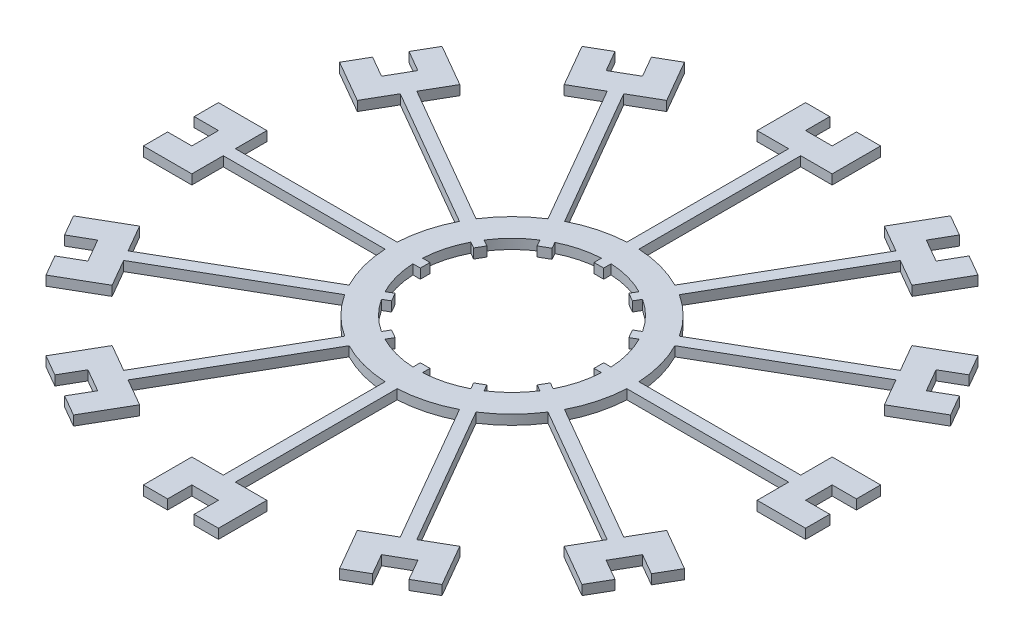
from build123d import *

# Parameters (mm, degrees)
BOSS_EXTRUDE1_DEPTH = 1


with BuildPart() as part:
    # Sketch1 → Boss-Extrude1 (new, symmetric)
    with BuildSketch(Plane(origin=(0, 0, 0), x_dir=(1, 0, 0), z_dir=(0, 1, 0))):
        with BuildLine():
            Line((-1.25, -58.39), (-7.75, -58.39))
            Line((-7.75, -58.39), (-7.75, -68.39))
            Line((-7.75, -68.39), (-2.75, -68.39))
            Line((-2.75, -68.39), (-2.75, -63.39))
            Line((-2.75, -63.39), (2.75, -63.39))
            Line((2.75, -63.39), (2.75, -68.39))
            Line((2.75, -68.39), (7.75, -68.39))
            Line((7.75, -68.39), (7.75, -58.39))
            Line((7.75, -58.39), (1.25, -58.39))
            Line((1.25, -58.39), (1.25, -24.968730444))
            ThreePointArc((1.25, -24.968730444), (6.470476128, -24.148145657), (11.401833467, -22.248554865))
            Line((11.401833467, -22.248554865), (28.112468245, -51.192223327))
            Line((28.112468245, -51.192223327), (22.483303121, -54.442223327))
            Line((22.483303121, -54.442223327), (27.483303121, -63.102477365))
            Line((27.483303121, -63.102477365), (31.81343014, -60.602477365))
            Line((31.81343014, -60.602477365), (29.31343014, -56.272350346))
            Line((29.31343014, -56.272350346), (34.07656986, -53.522350346))
            Line((34.07656986, -53.522350346), (36.57656986, -57.852477365))
            Line((36.57656986, -57.852477365), (40.906696879, -55.352477365))
            Line((40.906696879, -55.352477365), (35.906696879, -46.692223327))
            Line((35.906696879, -46.692223327), (30.277531755, -49.942223327))
            Line((30.277531755, -49.942223327), (13.566896977, -20.998554865))
            ThreePointArc((13.566896977, -20.998554865), (17.67766953, -17.67766953), (20.998554865, -13.566896977))
            Line((20.998554865, -13.566896977), (49.942223327, -30.277531755))
            Line((49.942223327, -30.277531755), (46.692223327, -35.906696879))
            Line((46.692223327, -35.906696879), (55.352477365, -40.906696879))
            Line((55.352477365, -40.906696879), (57.852477365, -36.57656986))
            Line((57.852477365, -36.57656986), (53.522350346, -34.07656986))
            Line((53.522350346, -34.07656986), (56.272350346, -29.31343014))
            Line((56.272350346, -29.31343014), (60.602477365, -31.81343014))
            Line((60.602477365, -31.81343014), (63.102477365, -27.483303121))
            Line((63.102477365, -27.483303121), (54.442223327, -22.483303121))
            Line((54.442223327, -22.483303121), (51.192223327, -28.112468245))
            Line((51.192223327, -28.112468245), (22.248554865, -11.401833467))
            ThreePointArc((22.248554865, -11.401833467), (24.148145657, -6.470476128), (24.968730444, -1.25))
            Line((24.968730444, -1.25), (58.39, -1.25))
            Line((58.39, -1.25), (58.39, -7.75))
            Line((58.39, -7.75), (68.39, -7.75))
            Line((68.39, -7.75), (68.39, -2.75))
            Line((68.39, -2.75), (63.39, -2.75))
            Line((63.39, -2.75), (63.39, 2.75))
            Line((63.39, 2.75), (68.39, 2.75))
            Line((68.39, 2.75), (68.39, 7.75))
            Line((68.39, 7.75), (58.39, 7.75))
            Line((58.39, 7.75), (58.39, 1.25))
            Line((58.39, 1.25), (24.968730444, 1.25))
            ThreePointArc((24.968730444, 1.25), (24.148145657, 6.470476128), (22.248554865, 11.401833467))
            Line((22.248554865, 11.401833467), (51.192223327, 28.112468245))
            Line((51.192223327, 28.112468245), (54.442223327, 22.483303121))
            Line((54.442223327, 22.483303121), (63.102477365, 27.483303121))
            Line((63.102477365, 27.483303121), (60.602477365, 31.81343014))
            Line((60.602477365, 31.81343014), (56.272350346, 29.31343014))
            Line((56.272350346, 29.31343014), (53.522350346, 34.07656986))
            Line((53.522350346, 34.07656986), (57.852477365, 36.57656986))
            Line((57.852477365, 36.57656986), (55.352477365, 40.906696879))
            Line((55.352477365, 40.906696879), (46.692223327, 35.906696879))
            Line((46.692223327, 35.906696879), (49.942223327, 30.277531755))
            Line((49.942223327, 30.277531755), (20.998554865, 13.566896977))
            ThreePointArc((20.998554865, 13.566896977), (17.67766953, 17.67766953), (13.566896977, 20.998554865))
            Line((13.566896977, 20.998554865), (30.277531755, 49.942223327))
            Line((30.277531755, 49.942223327), (35.906696879, 46.692223327))
            Line((35.906696879, 46.692223327), (40.906696879, 55.352477365))
            Line((40.906696879, 55.352477365), (36.57656986, 57.852477365))
            Line((36.57656986, 57.852477365), (34.07656986, 53.522350346))
            Line((34.07656986, 53.522350346), (29.31343014, 56.272350346))
            Line((29.31343014, 56.272350346), (31.81343014, 60.602477365))
            Line((31.81343014, 60.602477365), (27.483303121, 63.102477365))
            Line((27.483303121, 63.102477365), (22.483303121, 54.442223327))
            Line((22.483303121, 54.442223327), (28.112468245, 51.192223327))
            Line((28.112468245, 51.192223327), (11.401833467, 22.248554865))
            ThreePointArc((11.401833467, 22.248554865), (6.470476128, 24.148145657), (1.25, 24.968730444))
            Line((1.25, 24.968730444), (1.25, 58.39))
            Line((1.25, 58.39), (7.75, 58.39))
            Line((7.75, 58.39), (7.75, 68.39))
            Line((7.75, 68.39), (2.75, 68.39))
            Line((2.75, 68.39), (2.75, 63.39))
            Line((2.75, 63.39), (-2.75, 63.39))
            Line((-2.75, 63.39), (-2.75, 68.39))
            Line((-2.75, 68.39), (-7.75, 68.39))
            Line((-7.75, 68.39), (-7.75, 58.39))
            Line((-7.75, 58.39), (-1.25, 58.39))
            Line((-1.25, 58.39), (-1.25, 24.968730444))
            ThreePointArc((-1.25, 24.968730444), (-6.462536959, 24.150271552), (-11.387202364, 22.256046871))
            Line((-11.387202364, 22.256046871), (-28.112468245, 51.192223327))
            Line((-28.112468245, 51.192223327), (-22.483303121, 54.442223327))
            Line((-22.483303121, 54.442223327), (-27.483303121, 63.102477365))
            Line((-27.483303121, 63.102477365), (-31.81343014, 60.602477365))
            Line((-31.81343014, 60.602477365), (-29.31343014, 56.272350346))
            Line((-29.31343014, 56.272350346), (-34.07656986, 53.522350346))
            Line((-34.07656986, 53.522350346), (-36.57656986, 57.852477365))
            Line((-36.57656986, 57.852477365), (-40.906696879, 55.352477365))
            Line((-40.906696879, 55.352477365), (-35.906696879, 46.692223327))
            Line((-35.906696879, 46.692223327), (-30.277531755, 49.942223327))
            Line((-30.277531755, 49.942223327), (-13.566896977, 20.998554865))
            ThreePointArc((-13.566896977, 20.998554865), (-17.67766953, 17.67766953), (-20.998554865, 13.566896977))
            Line((-20.998554865, 13.566896977), (-49.942223327, 30.277531755))
            Line((-49.942223327, 30.277531755), (-46.692223327, 35.906696879))
            Line((-46.692223327, 35.906696879), (-55.352477365, 40.906696879))
            Line((-55.352477365, 40.906696879), (-57.852477365, 36.57656986))
            Line((-57.852477365, 36.57656986), (-53.522350346, 34.07656986))
            Line((-53.522350346, 34.07656986), (-56.272350346, 29.31343014))
            Line((-56.272350346, 29.31343014), (-60.602477365, 31.81343014))
            Line((-60.602477365, 31.81343014), (-63.102477365, 27.483303121))
            Line((-63.102477365, 27.483303121), (-54.442223327, 22.483303121))
            Line((-54.442223327, 22.483303121), (-51.192223327, 28.112468245))
            Line((-51.192223327, 28.112468245), (-22.248554865, 11.401833467))
            ThreePointArc((-22.248554865, 11.401833467), (-24.148145657, 6.470476128), (-24.968730444, 1.25))
            Line((-24.968730444, 1.25), (-58.39, 1.25))
            Line((-58.39, 1.25), (-58.39, 7.75))
            Line((-58.39, 7.75), (-68.39, 7.75))
            Line((-68.39, 7.75), (-68.39, 2.75))
            Line((-68.39, 2.75), (-63.39, 2.75))
            Line((-63.39, 2.75), (-63.39, -2.75))
            Line((-63.39, -2.75), (-68.39, -2.75))
            Line((-68.39, -2.75), (-68.39, -7.75))
            Line((-68.39, -7.75), (-58.39, -7.75))
            Line((-58.39, -7.75), (-58.39, -1.25))
            Line((-58.39, -1.25), (-24.968730444, -1.25))
            ThreePointArc((-24.968730444, -1.25), (-24.148145657, -6.470476128), (-22.248554865, -11.401833467))
            Line((-22.248554865, -11.401833467), (-51.192223327, -28.112468245))
            Line((-51.192223327, -28.112468245), (-54.442223327, -22.483303121))
            Line((-54.442223327, -22.483303121), (-63.102477365, -27.483303121))
            Line((-63.102477365, -27.483303121), (-60.602477365, -31.81343014))
            Line((-60.602477365, -31.81343014), (-56.272350346, -29.31343014))
            Line((-56.272350346, -29.31343014), (-53.522350346, -34.07656986))
            Line((-53.522350346, -34.07656986), (-57.852477365, -36.57656986))
            Line((-57.852477365, -36.57656986), (-55.352477365, -40.906696879))
            Line((-55.352477365, -40.906696879), (-46.692223327, -35.906696879))
            Line((-46.692223327, -35.906696879), (-49.942223327, -30.277531755))
            Line((-49.942223327, -30.277531755), (-20.998554865, -13.566896977))
            ThreePointArc((-20.998554865, -13.566896977), (-17.67766953, -17.67766953), (-13.566896977, -20.998554865))
            Line((-13.566896977, -20.998554865), (-30.277531755, -49.942223327))
            Line((-30.277531755, -49.942223327), (-35.906696879, -46.692223327))
            Line((-35.906696879, -46.692223327), (-40.906696879, -55.352477365))
            Line((-40.906696879, -55.352477365), (-36.57656986, -57.852477365))
            Line((-36.57656986, -57.852477365), (-34.07656986, -53.522350346))
            Line((-34.07656986, -53.522350346), (-29.31343014, -56.272350346))
            Line((-29.31343014, -56.272350346), (-31.81343014, -60.602477365))
            Line((-31.81343014, -60.602477365), (-27.483303121, -63.102477365))
            Line((-27.483303121, -63.102477365), (-22.483303121, -54.442223327))
            Line((-22.483303121, -54.442223327), (-28.112468245, -51.192223327))
            Line((-28.112468245, -51.192223327), (-11.401833467, -22.248554865))
            ThreePointArc((-11.401833467, -22.248554865), (-6.470476128, -24.148145657), (-1.25, -24.968730444))
            Line((-1.25, -24.968730444), (-1.25, -58.39))
        make_face()
        with BuildLine():
            Line((-7.873247017, 16.169706374), (-9.836025404, 15.036495744))
            Line((-9.836025404, 15.036495744), (-10.603196451, 16.365274976))
            ThreePointArc((-10.603196451, 16.365274976), (-13.788582233, 13.788582233), (-16.365274976, 10.603196451))
            Line((-16.365274976, 10.603196451), (-15.036495744, 9.836025404))
            Line((-15.036495744, 9.836025404), (-16.036495744, 8.103974596))
            Line((-16.036495744, 8.103974596), (-17.365274976, 8.871145643))
            ThreePointArc((-17.365274976, 8.871145643), (-18.835553613, 5.046971379), (-19.474342094, 1))
            Line((-19.474342094, 1), (-17.94, 1))
            Line((-17.94, 1), (-17.94, -1))
            Line((-17.94, -1), (-19.474342094, -1))
            ThreePointArc((-19.474342094, -1), (-18.835553613, -5.046971379), (-17.365274976, -8.871145643))
            Line((-17.365274976, -8.871145643), (-16.036495744, -8.103974596))
            Line((-16.036495744, -8.103974596), (-15.036495744, -9.836025404))
            Line((-15.036495744, -9.836025404), (-16.365274976, -10.603196451))
            ThreePointArc((-16.365274976, -10.603196451), (-13.788582233, -13.788582233), (-10.603196451, -16.365274976))
            Line((-10.603196451, -16.365274976), (-9.836025404, -15.036495744))
            Line((-9.836025404, -15.036495744), (-8.103974596, -16.036495744))
            Line((-8.103974596, -16.036495744), (-8.871145643, -17.365274976))
            ThreePointArc((-8.871145643, -17.365274976), (-5.046971379, -18.835553613), (-1, -19.474342094))
            Line((-1, -19.474342094), (-1, -17.94))
            Line((-1, -17.94), (1, -17.94))
            Line((1, -17.94), (1, -19.474342094))
            ThreePointArc((1, -19.474342094), (5.046971379, -18.835553613), (8.871145643, -17.365274976))
            Line((8.871145643, -17.365274976), (8.103974596, -16.036495744))
            Line((8.103974596, -16.036495744), (9.836025404, -15.036495744))
            Line((9.836025404, -15.036495744), (10.603196451, -16.365274976))
            ThreePointArc((10.603196451, -16.365274976), (13.788582233, -13.788582233), (16.365274976, -10.603196451))
            Line((16.365274976, -10.603196451), (15.036495744, -9.836025404))
            Line((15.036495744, -9.836025404), (16.036495744, -8.103974596))
            Line((16.036495744, -8.103974596), (17.365274976, -8.871145643))
            ThreePointArc((17.365274976, -8.871145643), (18.835553613, -5.046971379), (19.474342094, -1))
            Line((19.474342094, -1), (17.94, -1))
            Line((17.94, -1), (17.94, 1))
            Line((17.94, 1), (19.474342094, 1))
            ThreePointArc((19.474342094, 1), (18.835553613, 5.046971379), (17.365274976, 8.871145643))
            Line((17.365274976, 8.871145643), (16.036495744, 8.103974596))
            Line((16.036495744, 8.103974596), (15.036495744, 9.836025404))
            Line((15.036495744, 9.836025404), (16.365274976, 10.603196451))
            ThreePointArc((16.365274976, 10.603196451), (13.788582233, 13.788582233), (10.603196451, 16.365274976))
            Line((10.603196451, 16.365274976), (9.836025404, 15.036495744))
            Line((9.836025404, 15.036495744), (8.103974596, 16.036495744))
            Line((8.103974596, 16.036495744), (8.871145643, 17.365274976))
            ThreePointArc((8.871145643, 17.365274976), (5.046971379, 18.835553613), (1, 19.474342094))
            Line((1, 19.474342094), (1, 17.94))
            Line((1, 17.94), (-1, 17.94))
            Line((-1, 17.94), (-1, 19.474342094))
            ThreePointArc((-1, 19.474342094), (-4.917964249, 18.869648318), (-8.632664304, 17.485053818))
            Line((-8.632664304, 17.485053818), (-7.873247017, 16.169706374))
        make_face(mode=Mode.SUBTRACT)
    extrude(amount=BOSS_EXTRUDE1_DEPTH, both=True)


solid = part.part
